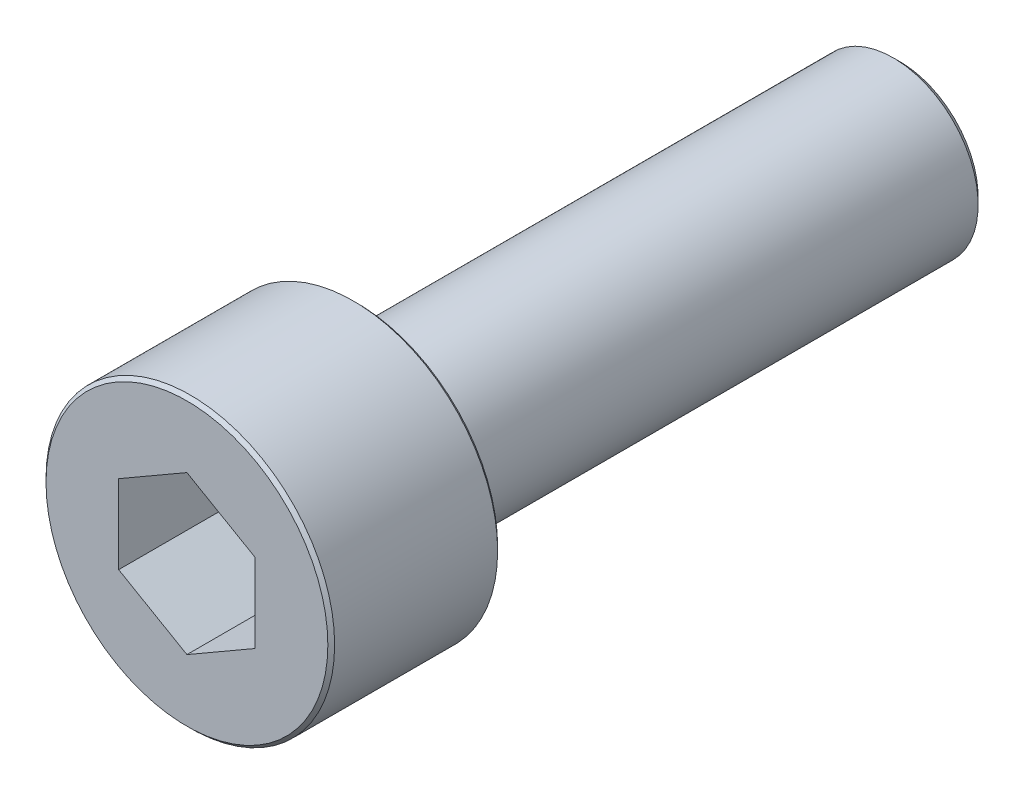
from build123d import *

# Parameters (mm, degrees)
SKETCH_1_W          = 4.25
SKETCH_1_H          = 5
SKETCH_2_R          = 2.5
EXTRUDE_1_DEPTH     = 16
CUT_EXTRUDE_1_DEPTH = 3.75
CHAMFER_1_SIZE2     = 0.099999698
CHAMFER_1_SIZE      = 0.099999743
CHAMFER_2_SIZE      = 0.200003867
CHAMFER_2_SIZE2     = 0.200004435


with BuildPart() as part:
    # 草图1 → 旋转1 (revolve)
    with BuildSketch(Plane(origin=(0, 0, 0), x_dir=(1, 0, 0), z_dir=(0, 1, 0))):
        with Locations((2.125, -18.5)):
            Rectangle(SKETCH_1_W, SKETCH_1_H)
    revolve(axis=Axis((0, 0, 16), (0, 0, 1)))

    # 草图2 → 凸台-拉伸1 (add)
    with BuildSketch(Plane(origin=(0, 0, 16), x_dir=(-1, 0, 0), z_dir=(0, 0, -1))):
        Circle(SKETCH_2_R)
    extrude(amount=EXTRUDE_1_DEPTH)

    # 草图3 → 切除-拉伸1 (cut)
    with BuildSketch(Plane.XY.offset(21)):
        Polygon((-2.01, -1.160474041), (0, -2.320948082), (2.01, -1.160474041), (2.01, 1.160474041), (0, 2.320948082), (-2.01, 1.160474041), align=None)
    extrude(amount=-CUT_EXTRUDE_1_DEPTH, mode=Mode.SUBTRACT)

    # 倒角1
    chamfer_1_edges = [part.edges().sort_by_distance(p)[0] for p in [
        (-4.25, 0, 21),
        (-4.25, 0, 16),
    ]]
    chamfer(chamfer_1_edges, length=CHAMFER_1_SIZE, length2=CHAMFER_1_SIZE2)

    # 倒角2
    chamfer_2_edges = [part.edges().sort_by_distance(p)[0] for p in [
        (2.5, 0, 0),
    ]]
    chamfer_2_side = [part.faces().sort_by_distance(p)[0] for p in [
        (2.5, 0, 8),
    ]]
    chamfer(chamfer_2_edges, length=CHAMFER_2_SIZE, length2=CHAMFER_2_SIZE2, reference=chamfer_2_side[0])


solid = part.part
